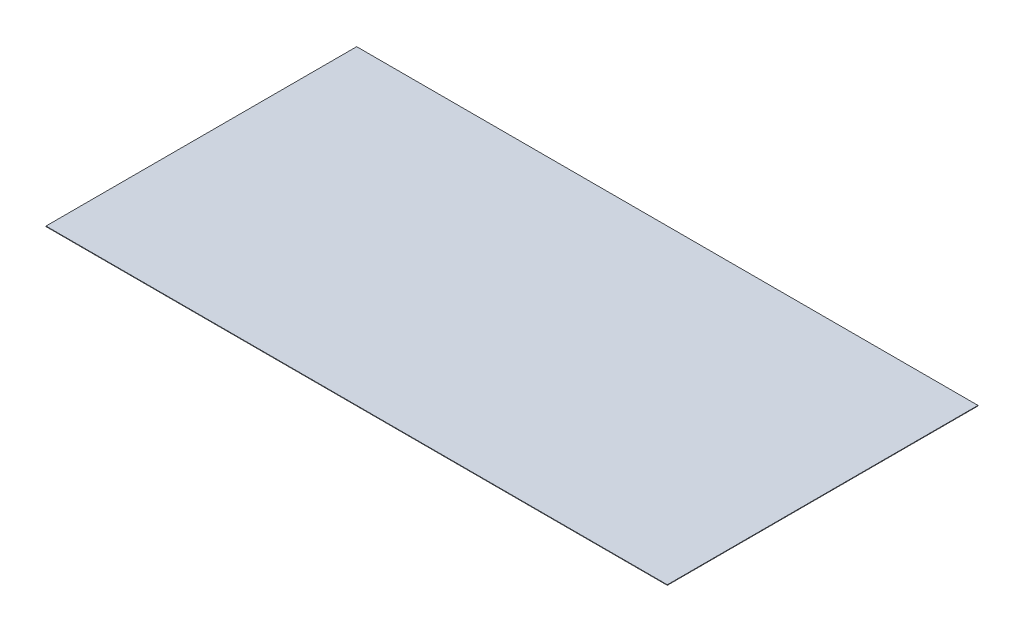
from build123d import *

# Parameters (mm, degrees)
SKETCH1_W           = 6088
SKETCH1_H           = 3044
BOSS_EXTRUDE1_DEPTH = 5


with BuildPart() as part:
    # Sketch1 → Boss-Extrude1 (new body)
    with BuildSketch(Plane(origin=(0, 0, 0), x_dir=(1, 0, 0), z_dir=(0, 1, 0))):
        Rectangle(SKETCH1_W, SKETCH1_H)
    extrude(amount=BOSS_EXTRUDE1_DEPTH)


solid = part.part
